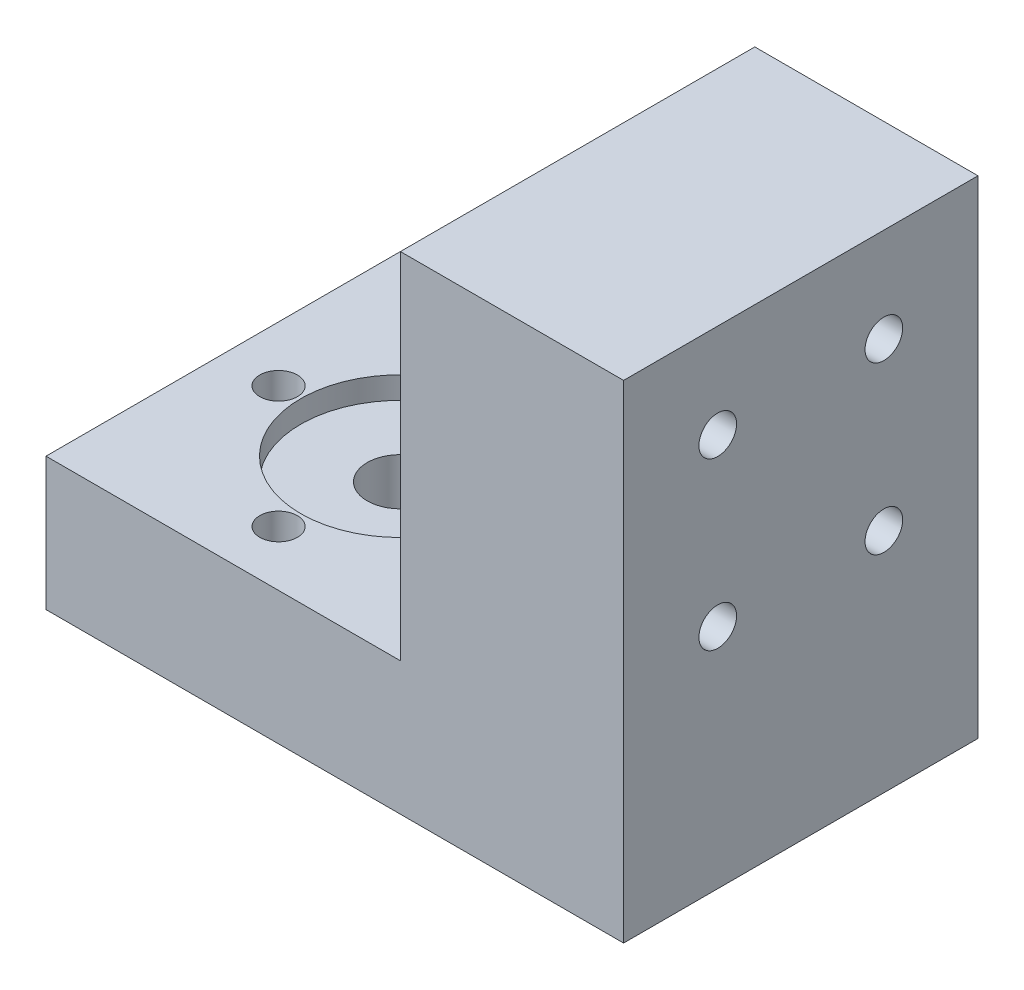
from build123d import *

# Parameters (mm, degrees)
SKETCH1_W           = 32
SKETCH1_H           = 32
BOSS_EXTRUDE1_DEPTH = 12
SKETCH3_R           = 9
CUT_EXTRUDE1_DEPTH  = 2
SKETCH5_R           = 3
CUT_EXTRUDE2_DEPTH  = 47.346520905
SKETCH6_R           = 1.7
CUT_EXTRUDE3_DEPTH  = 47.818799643
SKETCH7_W           = 32
SKETCH7_H           = 44
BOSS_EXTRUDE3_DEPTH = 20.152172572
SKETCH8_R           = 1.7
CUT_EXTRUDE4_DEPTH  = 64.118935352


with BuildPart() as part:
    # Sketch1 → Boss-Extrude1 (new body)
    with BuildSketch(Plane(origin=(0, 0, 0), x_dir=(1, 0, 0), z_dir=(0, 1, 0))):
        with Locations((16, 16)):
            Rectangle(SKETCH1_W, SKETCH1_H)
    extrude(amount=BOSS_EXTRUDE1_DEPTH)

    # Sketch3 → Cut-Extrude1 (cut)
    with BuildSketch(Plane(origin=(0, 12, 0), x_dir=(1, 0, 0), z_dir=(0, 1, 0))):
        with Locations(Location((16, 16, 0), (0, 0, 270))):
            Circle(SKETCH3_R)
    extrude(amount=-CUT_EXTRUDE1_DEPTH, mode=Mode.SUBTRACT)

    # Sketch5 → Cut-Extrude2 (cut, through all)
    with BuildSketch(Plane(origin=(0, 10, 0), x_dir=(1, 0, 0), z_dir=(0, 1, 0))):
        with Locations(Location((16, 16, 0), (0, 0, 270))):
            Circle(SKETCH5_R)
    extrude(amount=-CUT_EXTRUDE2_DEPTH, mode=Mode.SUBTRACT)

    # Sketch6 → Cut-Extrude3 (cut, through all)
    with BuildSketch(Plane(origin=(0, 12, 0), x_dir=(1, 0, 0), z_dir=(0, 1, 0))):
        with Locations(Location((16, 27, 0), (0, 0, 270))):
            Circle(SKETCH6_R)
        with Locations(Location((5, 16, 0), (0, 0, 270))):
            Circle(SKETCH6_R)
        with Locations(Location((16, 5, 0), (0, 0, 270))):
            Circle(SKETCH6_R)
        with Locations(Location((27, 16, 0), (0, 0, 270))):
            Circle(SKETCH6_R)
    extrude(amount=-CUT_EXTRUDE3_DEPTH, mode=Mode.SUBTRACT)

    # Sketch7 → Boss-Extrude3 (add)
    with BuildSketch(Plane(origin=(32, 0, 0), x_dir=(0, 0, -1), z_dir=(1, 0, 0))):
        with Locations((16, 22)):
            Rectangle(SKETCH7_W, SKETCH7_H)
    extrude(amount=BOSS_EXTRUDE3_DEPTH)

    # Sketch8 → Cut-Extrude4 (cut, through all)
    with BuildSketch(Plane.ZY.offset(-32)):
        with Locations((-23.5, 35.5)):
            Circle(SKETCH8_R)
        with Locations((-8.5, 35.5)):
            Circle(SKETCH8_R)
        with Locations((-8.5, 20.5)):
            Circle(SKETCH8_R)
        with Locations((-23.5, 20.5)):
            Circle(SKETCH8_R)
    extrude(amount=-CUT_EXTRUDE4_DEPTH, mode=Mode.SUBTRACT)


solid = part.part
